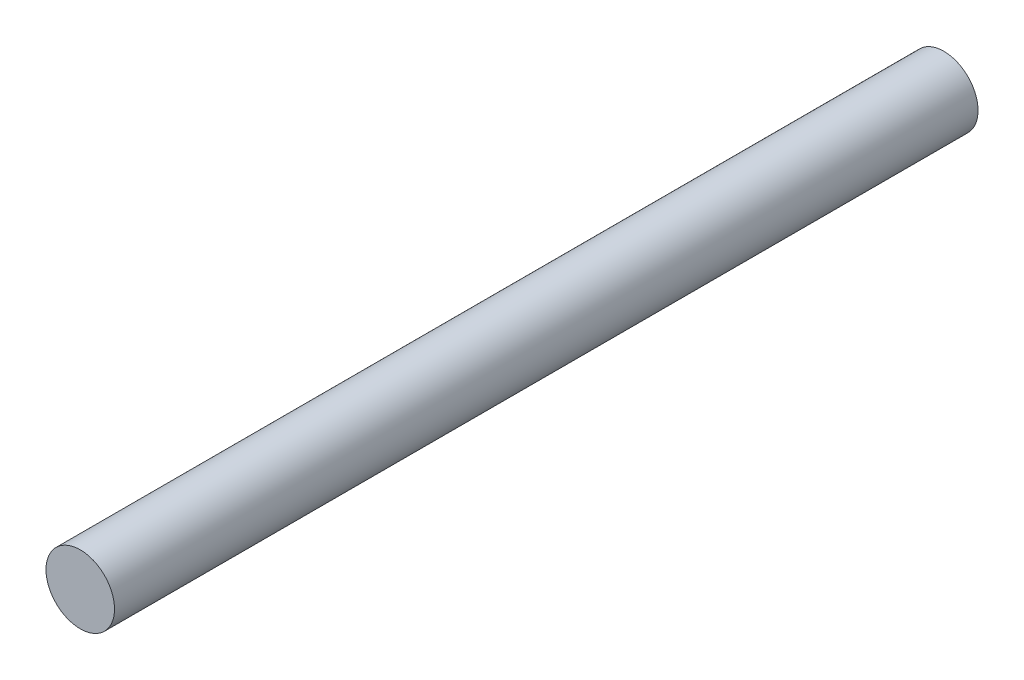
from build123d import *

# Parameters (mm, degrees)
SKETCH1_R           = 12.5
BOSS_EXTRUDE1_DEPTH = 315.08


with BuildPart() as part:
    # Sketch1 → Boss-Extrude1 (new body)
    with BuildSketch(Plane.XY):
        with Locations(Location((0, 0, 0), (0, 0, 180))):
            Circle(SKETCH1_R)
    extrude(amount=BOSS_EXTRUDE1_DEPTH)


solid = part.part
